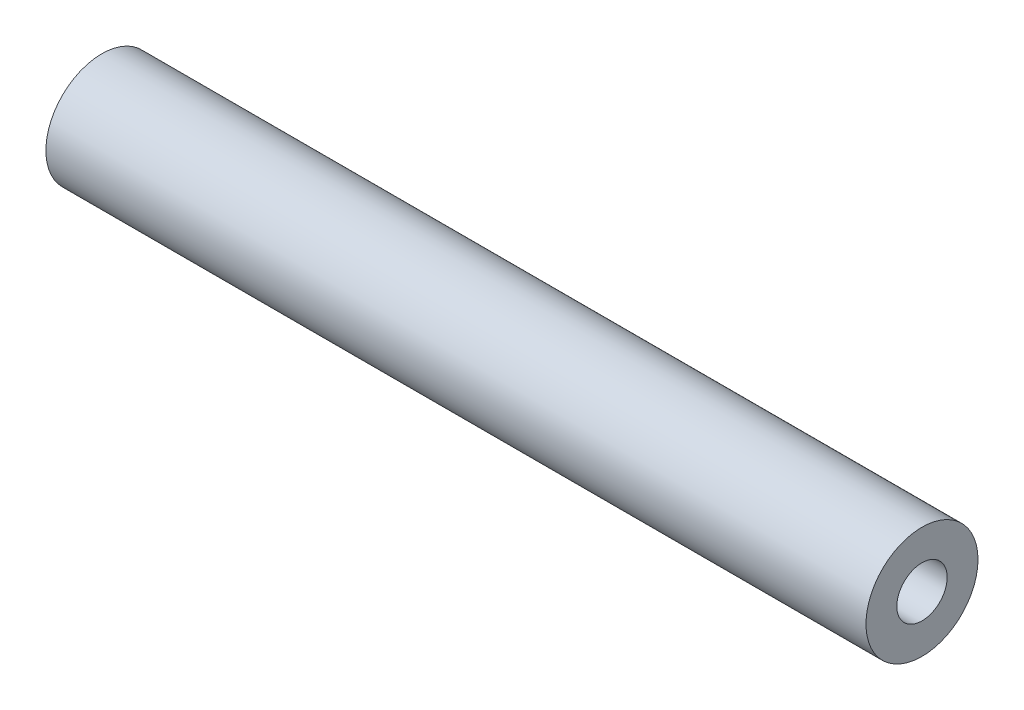
from build123d import *

# Parameters (mm, degrees)
SKETCH_3_R      = 4.45
SKETCH_3_R_2    = 2
EXTRUDE_1_DEPTH = 65.16


with BuildPart() as part:
    # 草图3 → 凸台-拉伸1 (new body)
    with BuildSketch(Plane(origin=(0, 0, 0), x_dir=(0, 0, -1), z_dir=(1, 0, 0))):
        Circle(SKETCH_3_R)
        Circle(SKETCH_3_R_2, mode=Mode.SUBTRACT)
    extrude(amount=EXTRUDE_1_DEPTH)


solid = part.part
